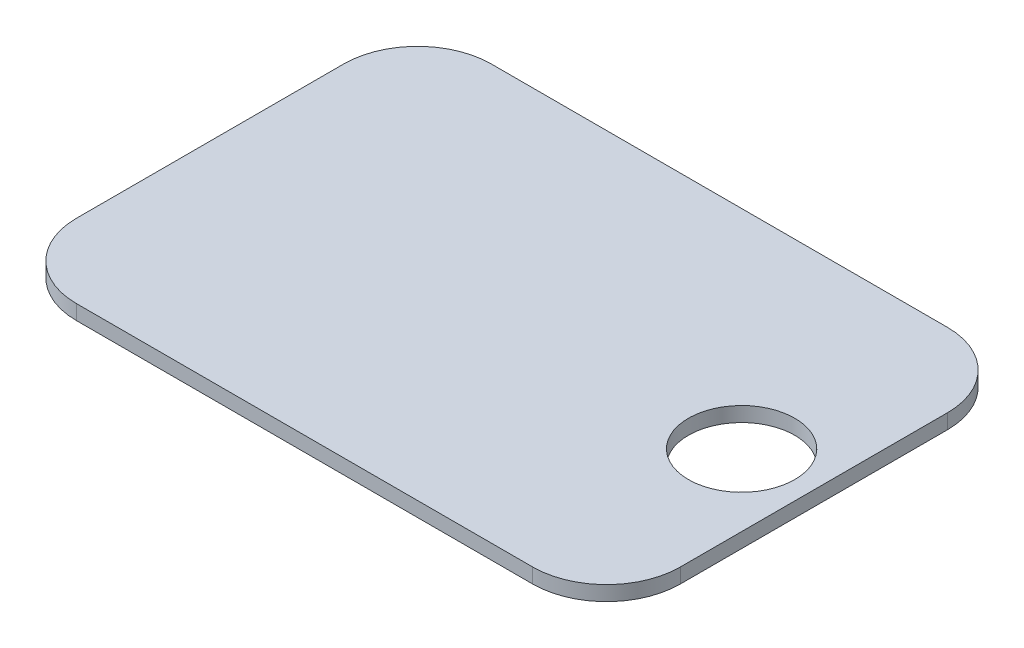
from build123d import *

# Parameters (mm, degrees)
SKETCH1_R           = 3.6
BOSS_EXTRUDE1_DEPTH = 1


with BuildPart() as part:
    # Sketch1 → Boss-Extrude1 (new body)
    with BuildSketch(Plane(origin=(0, 0, 0), x_dir=(1, 0, 0), z_dir=(0, 1, 0))):
        with BuildLine():
            Line((-5.140329218, 10.060493827), (25.759670782, 10.060493827))
            ThreePointArc((25.759670782, 10.060493827), (29.295204688, 8.596027733), (30.759670782, 5.060493827))
            Line((30.759670782, 5.060493827), (30.759670782, -13.039506173))
            ThreePointArc((30.759670782, -13.039506173), (29.295204688, -16.575040079), (25.759670782, -18.039506173))
            Line((25.759670782, -18.039506173), (-5.140329218, -18.039506173))
            ThreePointArc((-5.140329218, -18.039506173), (-8.675863124, -16.575040079), (-10.140329218, -13.039506173))
            Line((-10.140329218, -13.039506173), (-10.140329218, 5.060493827))
            ThreePointArc((-10.140329218, 5.060493827), (-8.675863124, 8.596027733), (-5.140329218, 10.060493827))
        make_face()
        with Locations(Location((25.909670782, -4.039506173, 0), (0, 0, 270))):
            Circle(SKETCH1_R, mode=Mode.SUBTRACT)
    extrude(amount=BOSS_EXTRUDE1_DEPTH)


solid = part.part
